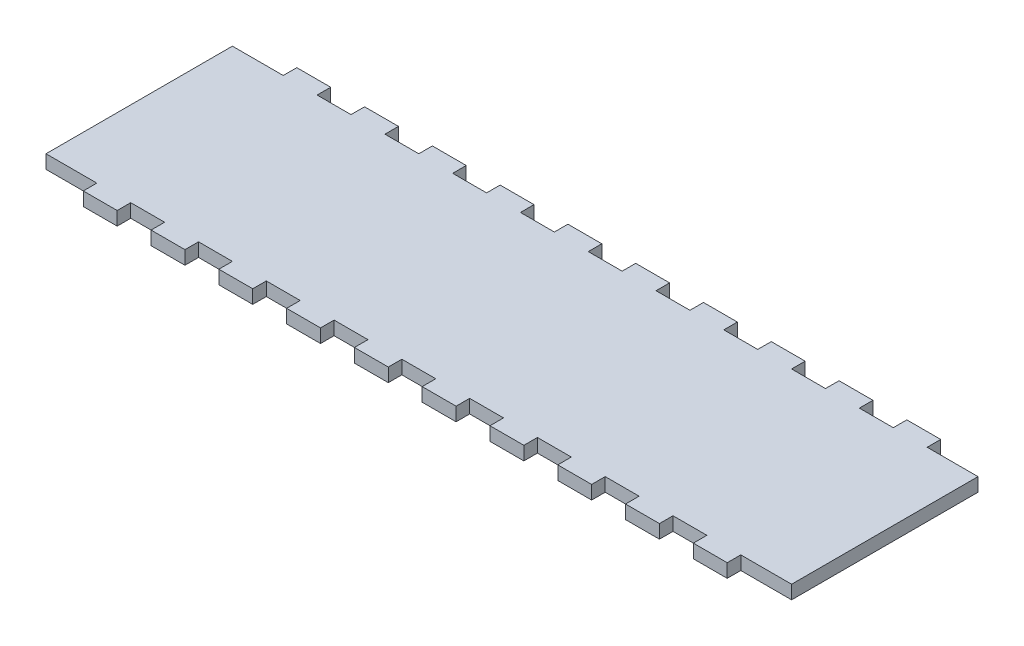
from build123d import *

# Parameters (mm, degrees)
EXTRUDE_2_DEPTH = 4


with BuildPart() as part:
    # Эскиз3 → Бобышка-Вытянуть2 (new body)
    with BuildSketch(Plane(origin=(0, 0, 0), x_dir=(1, 0, 0), z_dir=(0, 1, 0))):
        Polygon((110, -32), (110, 23), (95, 23), (95, 27), (85, 27), (85, 23), (75, 23), (75, 27), (65, 27), (65, 23), (55, 23), (55, 27), (45, 27), (45, 23), (35, 23), (35, 27), (25, 27), (25, 23), (15, 23), (15, 27), (5, 27), (5, 23), (-5, 23), (-5, 27), (-15, 27), (-15, 23), (-25, 23), (-25, 27), (-35, 27), (-35, 23), (-45, 23), (-45, 27), (-55, 27), (-55, 23), (-65, 23), (-65, 27), (-75, 27), (-75, 23), (-85, 23), (-85, 27), (-95, 27), (-95, 23), (-110, 23), (-110, -32), (-95, -32), (-95, -36), (-85, -36), (-85, -32), (-75, -32), (-75, -36), (-65, -36), (-65, -32), (-55, -32), (-55, -36), (-45, -36), (-45, -32), (-35, -32), (-35, -36), (-25, -36), (-25, -32), (-15, -32), (-15, -36), (-5, -36), (-5, -32), (5, -32), (5, -36), (15, -36), (15, -32), (25, -32), (25, -36), (35, -36), (35, -32), (45, -32), (45, -36), (55, -36), (55, -32), (65, -32), (65, -36), (75, -36), (75, -32), (85, -32), (85, -36), (95, -36), (95, -32), align=None)
    extrude(amount=EXTRUDE_2_DEPTH)


solid = part.part
